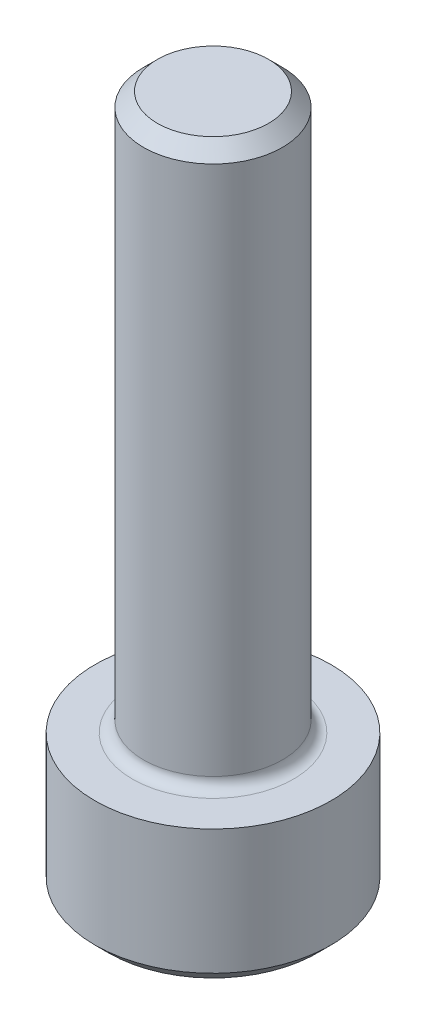
from build123d import *

# Parameters (mm, degrees)
SKETCH2_R           = 2.5
BOSS_EXTRUDE1_DEPTH = 20
SKETCH3_R           = 4.25
BOSS_EXTRUDE2_DEPTH = 5
FILLET1_R           = 0.4
CHAMFER1_SIZE       = 0.5
CUT_EXTRUDE1_DEPTH  = 2.5


with BuildPart() as part:
    # Sketch2 → Boss-Extrude1 (new body)
    with BuildSketch(Plane(origin=(0, 0, 0), x_dir=(1, 0, 0), z_dir=(0, 1, 0))):
        with Locations(Location((0, 0, 0), (0, 0, 270))):
            Circle(SKETCH2_R)
    extrude(amount=BOSS_EXTRUDE1_DEPTH)

    # Sketch3 → Boss-Extrude2 (add)
    with BuildSketch(Plane(origin=(0, 0, 0), x_dir=(1, 0, 0), z_dir=(0, 1, 0))):
        with Locations(Location((0, 0, 0), (0, 0, 270))):
            Circle(SKETCH3_R)
    extrude(amount=-BOSS_EXTRUDE2_DEPTH)

    # Fillet1
    fillet1_edges = [part.edges().sort_by_distance(p)[0] for p in [
        (0, 0, -2.5),
    ]]
    fillet(fillet1_edges, radius=FILLET1_R)

    # Chamfer1
    chamfer1_edges = [part.edges().sort_by_distance(p)[0] for p in [
        (0, 20, -2.5),
        (0, -5, -4.25),
    ]]
    chamfer(chamfer1_edges, length=CHAMFER1_SIZE)

    # Sketch4 → Cut-Extrude1 (cut)
    with BuildSketch(Plane.XZ.offset(5)):
        Polygon((0, 2.309401077), (-2, 1.154700538), (-2, -1.154700538), (0, -2.309401077), (2, -1.154700538), (2, 1.154700538), align=None)
    extrude(amount=-CUT_EXTRUDE1_DEPTH, mode=Mode.SUBTRACT)


solid = part.part
